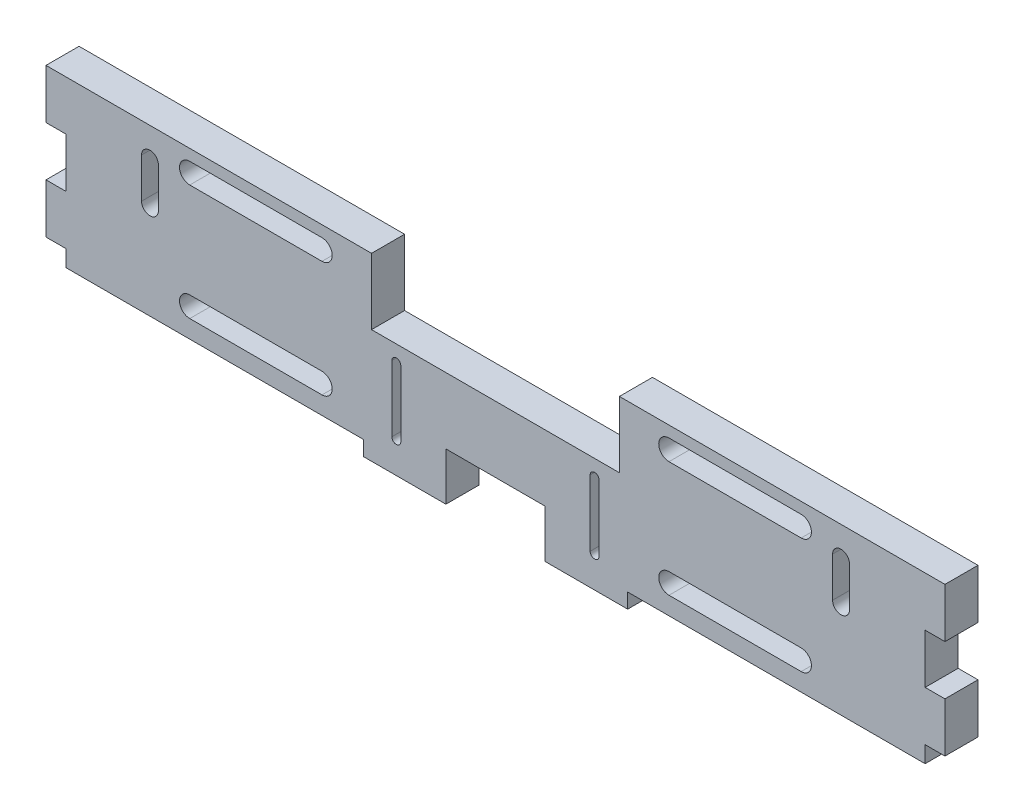
from build123d import *

# Parameters (mm, degrees)
EXTRUDE_1_DEPTH     = 10
CUT_EXTRUDE_1_DEPTH = 140.112364655
SKETCH_3_W          = 30
SKETCH_3_H          = 10
SKETCH_3_W_2        = 75
SKETCH_3_H_2        = 20
CUT_EXTRUDE_2_DEPTH = 140.112364655
SKETCH_4_W          = 25
SKETCH_4_H          = 10
EXTRUDE_2_DEPTH     = 4.5
CUT_EXTRUDE_3_DEPTH = 141.071410359


with BuildPart() as part:
    # 草圖1 → 填料-伸長1 (new body)
    with BuildSketch(Plane.XY):
        Polygon((136, -22.5), (136, -7.5), (130, -7.5), (130, 7.5), (136, 7.5), (136, 22.5), (-136, 22.5), (-136, 7.5), (-130, 7.5), (-130, -7.5), (-136, -7.5), (-136, -22.5), (-130, -22.5), (-130, -27.5), (130, -27.5), (130, -22.5), align=None)
        with BuildLine():
            Line((-31.35, -22.5), (-31.35, -2.5))
            ThreePointArc((-31.35, -2.5), (-30, -1.15), (-28.65, -2.5))
            Line((-28.65, -2.5), (-28.65, -22.5))
            ThreePointArc((-28.65, -22.5), (-30, -23.85), (-31.35, -22.5))
        make_face(mode=Mode.SUBTRACT)
        with BuildLine():
            Line((31.35, -22.5), (31.35, -2.5))
            ThreePointArc((31.35, -2.5), (30, -1.15), (28.65, -2.5))
            Line((28.65, -2.5), (28.65, -22.5))
            ThreePointArc((28.65, -22.5), (30, -23.85), (31.35, -22.5))
        make_face(mode=Mode.SUBTRACT)
    extrude(amount=EXTRUDE_1_DEPTH)

    # 草圖2 → 除料-伸長1 (cut, through all)
    with BuildSketch(Plane.XY.offset(10)):
        with BuildLine():
            Line((-92.5, 19.1), (-52.5, 19.1))
            ThreePointArc((-52.5, 19.1), (-49.4, 16), (-52.5, 12.9))
            Line((-52.5, 12.9), (-92.5, 12.9))
            ThreePointArc((-92.5, 12.9), (-95.6, 16), (-92.5, 19.1))
        make_face()
        with BuildLine():
            Line((-92.5, -15.9), (-52.5, -15.9))
            ThreePointArc((-52.5, -15.9), (-49.4, -19), (-52.5, -22.1))
            Line((-52.5, -22.1), (-92.5, -22.1))
            ThreePointArc((-92.5, -22.1), (-95.6, -19), (-92.5, -15.9))
        make_face()
        with BuildLine():
            Line((52.5, 19.1), (92.5, 19.1))
            ThreePointArc((92.5, 19.1), (95.6, 16), (92.5, 12.9))
            Line((92.5, 12.9), (52.5, 12.9))
            ThreePointArc((52.5, 12.9), (49.4, 16), (52.5, 19.1))
        make_face()
        with BuildLine():
            Line((52.5, -15.9), (92.5, -15.9))
            ThreePointArc((92.5, -15.9), (95.6, -19), (92.5, -22.1))
            Line((92.5, -22.1), (52.5, -22.1))
            ThreePointArc((52.5, -22.1), (49.4, -19), (52.5, -15.9))
        make_face()
    extrude(amount=-CUT_EXTRUDE_1_DEPTH, mode=Mode.SUBTRACT)

    # 草圖3 → 除料-伸長2 (cut, through all)
    with BuildSketch(Plane.XY.offset(10)):
        with Locations((0, -22.5)):
            Rectangle(SKETCH_3_W, SKETCH_3_H)
        with Locations((0, 12.5)):
            Rectangle(SKETCH_3_W_2, SKETCH_3_H_2)
    extrude(amount=-CUT_EXTRUDE_2_DEPTH, mode=Mode.SUBTRACT)

    # 草圖4 → 填料-伸長2 (add)
    with BuildSketch(Plane.XZ.offset(27.5)):
        with Locations((-27.5, 5)):
            Rectangle(SKETCH_4_W, SKETCH_4_H)
        with Locations((27.5, 5)):
            Rectangle(SKETCH_4_W, SKETCH_4_H)
    extrude(amount=EXTRUDE_2_DEPTH)

    # 草圖5 → 除料-伸長3 (cut, through all)
    with BuildSketch(Plane.XY.offset(10)):
        with BuildLine():
            Line((-107.1, 13.45), (-107.1, 1.35))
            ThreePointArc((-107.1, 1.35), (-104.55, -1.2), (-102, 1.35))
            Line((-102, 1.35), (-102, 13.45))
            ThreePointArc((-102, 13.45), (-104.55, 16), (-107.1, 13.45))
        make_face()
        with BuildLine():
            Line((107.1, 13.45), (107.1, 1.35))
            ThreePointArc((107.1, 1.35), (104.55, -1.2), (102, 1.35))
            Line((102, 1.35), (102, 13.45))
            ThreePointArc((102, 13.45), (104.55, 16), (107.1, 13.45))
        make_face()
    extrude(amount=-CUT_EXTRUDE_3_DEPTH, mode=Mode.SUBTRACT)


solid = part.part
